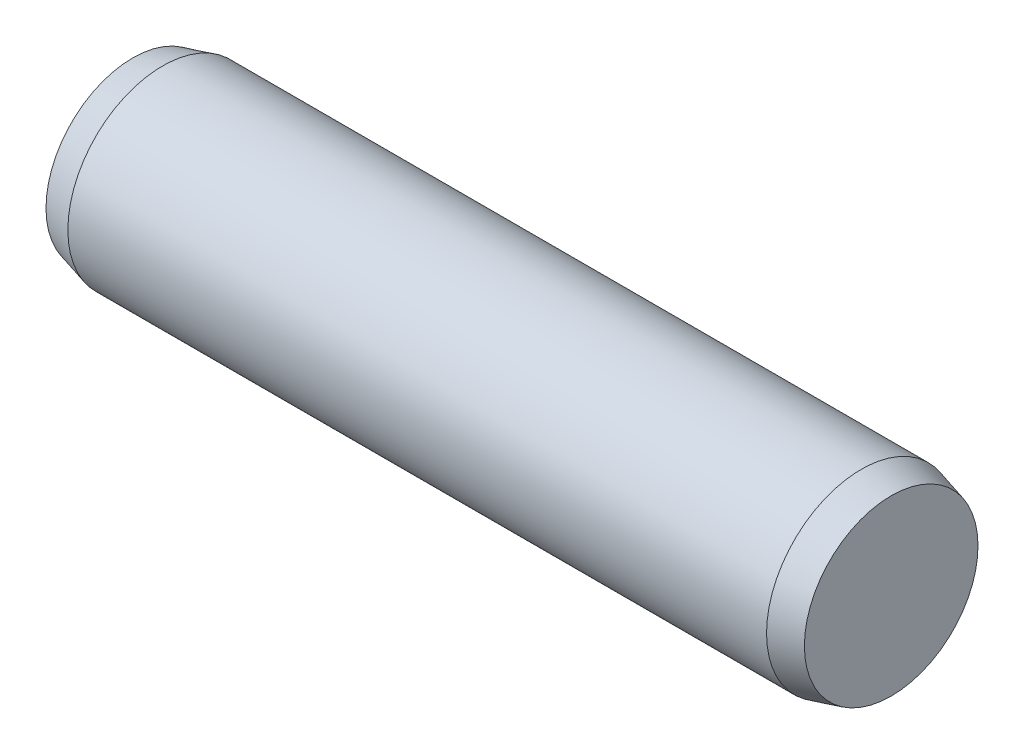
from build123d import *


with BuildPart() as part:
    # Sketch1 → Base-Revolve (revolve)
    with BuildSketch(Plane.XY, mode=Mode.PRIVATE) as base_revolve_sk:
        Polygon((0, 0), (16, 0), (16, 1.831192009), (15.37, 2), (0.63, 2), (0, 1.831192009), align=None)
    revolve(base_revolve_sk.sketch.rotate(Axis((-6.35, 0, 0), (1, 0, 0)), 90), axis=Axis((-6.35, 0, 0), (1, 0, 0)))


solid = part.part
